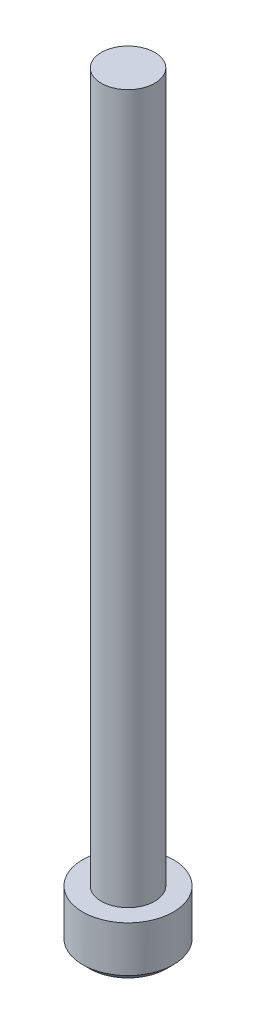
from build123d import *

# Parameters (mm, degrees)
SKETCH1_R           = 6.4
BOSS_EXTRUDE1_DEPTH = 7.45
SKETCH2_R           = 3.775
BOSS_EXTRUDE2_DEPTH = 100
CUT_EXTRUDE1_DEPTH  = 5


with BuildPart() as part:
    # Sketch1 → Boss-Extrude1 (new body)
    with BuildSketch(Plane(origin=(0, 0, 0), x_dir=(1, 0, 0), z_dir=(0, 1, 0))):
        with Locations(Location((0, 0, 0), (0, 0, 270))):
            Circle(SKETCH1_R)
    extrude(amount=BOSS_EXTRUDE1_DEPTH)

    # Sketch2 → Boss-Extrude2 (add)
    with BuildSketch(Plane(origin=(0, 7.45, 0), x_dir=(1, 0, 0), z_dir=(0, 1, 0))):
        with Locations(Location((0, 0, 0), (0, 0, 270))):
            Circle(SKETCH2_R)
    extrude(amount=BOSS_EXTRUDE2_DEPTH)

    # Sketch3 → Cut-Extrude1 (cut)
    with BuildSketch(Plane.XZ):
        Polygon((-3.608439182, 0), (-1.804219591, -3.125), (1.804219591, -3.125), (3.608439182, 0), (1.804219591, 3.125), (-1.804219591, 3.125), align=None)
    extrude(amount=-CUT_EXTRUDE1_DEPTH, mode=Mode.SUBTRACT)

    # Sketch4 → Cut-Revolve1 (revolve, cut)
    with BuildSketch(Plane(origin=(0, 0, 0), x_dir=(0, 0, -1), z_dir=(1, 0, 0))):
        Polygon((5.4, 0), (6.4, 1), (6.4, 0), align=None)
    revolve(axis=Axis((0, 0, 0), (0, 1, 0)), mode=Mode.SUBTRACT)


solid = part.part
